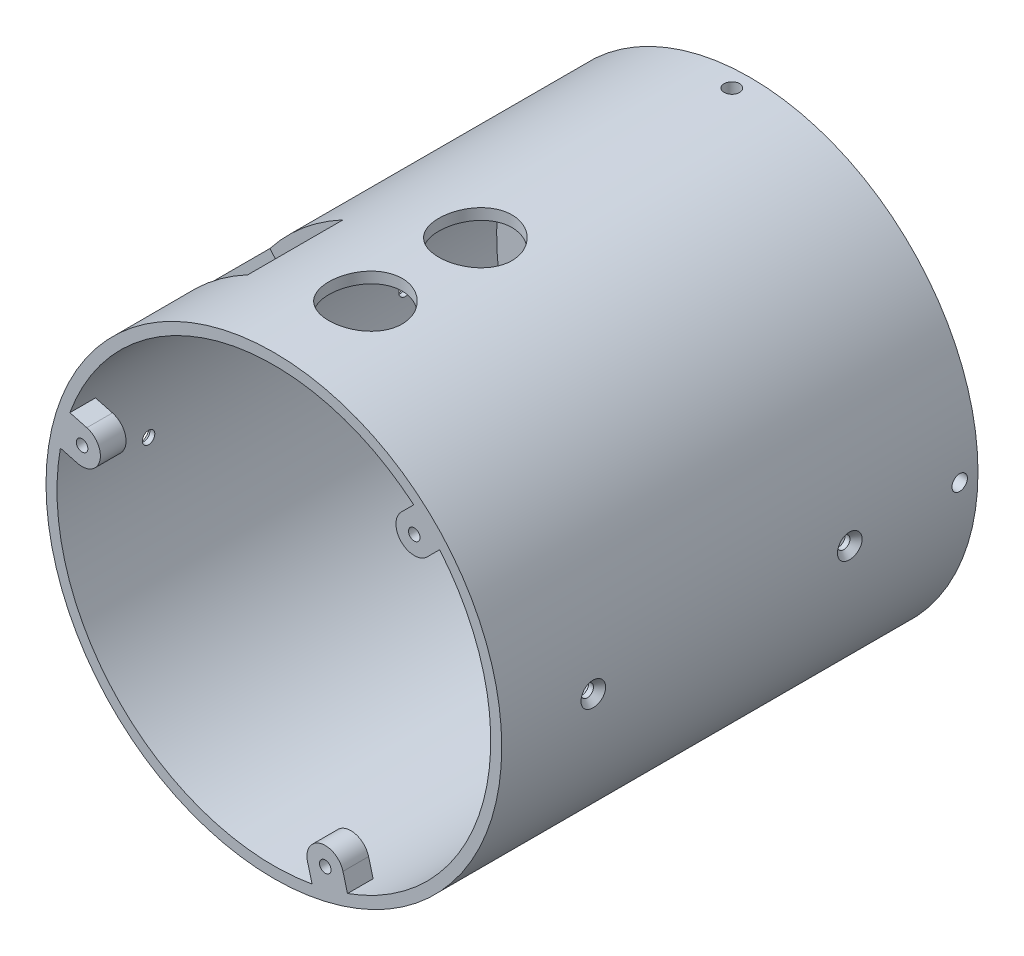
from build123d import *

# Parameters (mm, degrees)
IZIM1_R                                     = 62.2
Y_KSEKLIK_EKSTR_ZYON1_DEPTH                 = 10
IZIM2_R                                     = 62.2
IZIM2_R_2                                   = 59.2
EKSTR_ZYON_NCE1_DEPTH                       = 120
IZIM3_R                                     = 10
KES_EKSTR_ZYON1_DEPTH                       = 20
IZIM7_W                                     = 26
IZIM7_H                                     = 26
KES_EKSTR_ZYON2_DEPTH                       = 20
Y_KSEKLIK_EKSTR_ZYON2_DEPTH                 = 7
DAIRESEL_KAPLAMA1_COUNT                     = 3
DAIRESEL_KAPLAMA3_COUNT                     = 4
M3_ALT_GEN_ALYAN_HAV_A_BA_L_K_R_VID_2_COUNT = 2
M3_ALT_GEN_ALYAN_HAV_A_BA_L_K_R_VID_2_PITCH = 70
DAIRESEL_KAPLAMA4_COUNT                     = 2
DAIRESEL_KAPLAMA5_COUNT                     = 3


with BuildPart() as part:
    # Çizim1 → Yükseklik-Ekstrüzyon1 (new body)
    with BuildSketch(Plane.XY):
        Circle(IZIM1_R)
    extrude(amount=Y_KSEKLIK_EKSTR_ZYON1_DEPTH)

    # Çizim2 → Ekstrüzyon-İnce1 (add)
    with BuildSketch(Plane.XY.offset(10)):
        Circle(IZIM2_R)
        Circle(IZIM2_R_2, mode=Mode.SUBTRACT)
    extrude(amount=EKSTR_ZYON_NCE1_DEPTH)

    # Çizim3 → Kes-Ekstrüzyon1 (cut)
    with BuildSketch(Plane(origin=(0, 62.2, 0), x_dir=(1, 0, 0), z_dir=(0, 1, 0))):
        with Locations(Location((0, -75, 0), (0, 0, 270))):
            Circle(IZIM3_R)
        with Locations(Location((0, -105, 0), (0, 0, 270))):
            Circle(IZIM3_R)
    extrude(amount=-KES_EKSTR_ZYON1_DEPTH, mode=Mode.SUBTRACT)

    # Çizim7 → Kes-Ekstrüzyon2 (cut)
    with BuildSketch(Plane(origin=(-39.981389323, 47.647964362, 0), x_dir=(-0.7660444431189766, -0.6427876096865413, 0), z_dir=(0.6427876096865411, -0.7660444431189765, 0))):
        with Locations((0, -95)):
            Rectangle(IZIM7_W, IZIM7_H)
    extrude(amount=KES_EKSTR_ZYON2_DEPTH, mode=Mode.SUBTRACT)

    # Çizim8 → Yükseklik-Ekstrüzyon2 (add)
    with BuildSketch(Plane.XY.offset(130)):
        with BuildLine():
            Line((38.32518754, 45.396255352), (45.396255352, 38.32518754))
            Line((45.396255352, 38.32518754), (41.860721446, 34.789653634))
            ThreePointArc((41.860721446, 34.789653634), (34.789653634, 34.789653634), (34.789653634, 41.860721446))
            Line((34.789653634, 41.860721446), (38.32518754, 45.396255352))
        make_face()
    y_kseklik_ekstr_zyon2 = extrude(amount=-Y_KSEKLIK_EKSTR_ZYON2_DEPTH)

    # Dairesel Kaplama1: Yükseklik-Ekstrüzyon2 ×3 about axis
    dairesel_kaplama1_axis = Axis((0, 0, 0), (0, 0, 1))
    for i in range(1, DAIRESEL_KAPLAMA1_COUNT):
        add(y_kseklik_ekstr_zyon2.rotate(dairesel_kaplama1_axis, i * 360 / DAIRESEL_KAPLAMA1_COUNT))

    # Çizim12 → M3x0.5 Helisarmal İçin Dişli Delik1 (revolve, cut)
    with BuildSketch(Plane(origin=(-52.353179785, 14.027992245, 130), x_dir=(0, -1, 0), z_dir=(1, 0, 0))):
        Polygon((0, 0), (0, 8.446355475), (1.575, 7.5), (1.575, 0), align=None)
    m3x0_5_helisarmal_in_di_li_delik1 = revolve(axis=Axis((-52.353179785, 14.027992245, 136.35), (0, 0, -1)), mode=Mode.SUBTRACT)

    # Çizim14 → M4x0.7 Helisarmal İçin Dişli Delik2 (revolve, cut)
    with BuildSketch(Plane(origin=(0, 62.2, 5), x_dir=(0, 0, 1), z_dir=(1, 0, 0))):
        Polygon((0, 0), (0, 11.4618073), (2.1, 10.2), (2.1, 0), align=None)
    m4x0_7_helisarmal_in_di_li_delik2 = revolve(axis=Axis((0, 68.55, 5), (0, -1, 0)), mode=Mode.SUBTRACT)

    # Dairesel Kaplama3: M4x0.7 Helisarmal İçin Dişli Delik2 ×4 about axis
    dairesel_kaplama3_axis = Axis((0, 0, 0), (0, 0, 1))
    for i in range(1, DAIRESEL_KAPLAMA3_COUNT):
        add(m4x0_7_helisarmal_in_di_li_delik2.rotate(dairesel_kaplama3_axis, i * 360 / DAIRESEL_KAPLAMA3_COUNT), mode=Mode.SUBTRACT)

    # Çizim16 → M3 Altıgen Alyan Havşa Başlı Kör Vida İçin Havşa1 (revolve, cut)
    with BuildSketch(Plane(origin=(62.2, 0, 35), x_dir=(0, 0, -1), z_dir=(0, 1, 0))):
        Polygon((0, 0), (0, 11.221463052), (1.7, 10.2), (1.7, 1.66), (3.36, 0), align=None)
    m3_alt_gen_alyan_hav_a_ba_l_k_r_vida_i = revolve(axis=Axis((68.55, 0, 35), (-1, 0, 0)), mode=Mode.SUBTRACT)

    # M3 Alt_gen Alyan Hav_a Ba_l_ K_r Vid 2: M3 Altıgen Alyan Havşa Başlı Kör Vida İçin Havşa1 ×2
    with Locations(*[(0, 0, i * M3_ALT_GEN_ALYAN_HAV_A_BA_L_K_R_VID_2_PITCH) for i in range(1, M3_ALT_GEN_ALYAN_HAV_A_BA_L_K_R_VID_2_COUNT)]):
        add(m3_alt_gen_alyan_hav_a_ba_l_k_r_vida_i, mode=Mode.SUBTRACT)

    # Dairesel Kaplama4: M3 Altıgen Alyan Havşa Başlı Kör Vida İçin Havşa1 ×2 about axis
    dairesel_kaplama4_axis = Axis((0, 0, 0), (0, 0, -1))
    for i in range(1, DAIRESEL_KAPLAMA4_COUNT):
        add(m3_alt_gen_alyan_hav_a_ba_l_k_r_vida_i.rotate(dairesel_kaplama4_axis, i * 360 / DAIRESEL_KAPLAMA4_COUNT), mode=Mode.SUBTRACT)

    # Dairesel Kaplama4 copy 1 sketch → Dairesel Kaplama4 copy 1 (revolve, cut)
    with BuildSketch(Plane(origin=(-62.2, 0, 105), x_dir=(0, 0, -1), z_dir=(0, -1, 0))):
        Polygon((0, 0), (0, 11.221463052), (1.7, 10.2), (1.7, 1.66), (3.36, 0), align=None)
    revolve(axis=Axis((-68.55, 0, 105), (1, 0, 0)), mode=Mode.SUBTRACT)

    # Dairesel Kaplama5: M3x0.5 Helisarmal İçin Dişli Delik1 ×3 about axis
    dairesel_kaplama5_axis = Axis((0, 0, 0), (0, 0, 1))
    for i in range(1, DAIRESEL_KAPLAMA5_COUNT):
        add(m3x0_5_helisarmal_in_di_li_delik1.rotate(dairesel_kaplama5_axis, i * 360 / DAIRESEL_KAPLAMA5_COUNT), mode=Mode.SUBTRACT)


solid = part.part
